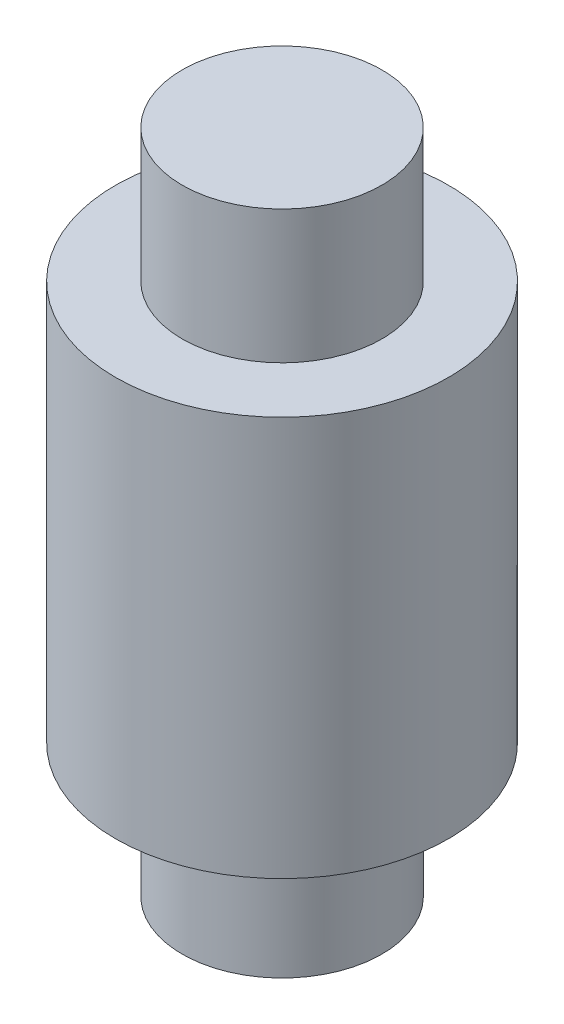
from build123d import *

# Parameters (mm, degrees)
SKETCH_1_R      = 2.5
EXTRUDE_1_DEPTH = 6
SKETCH_2_R      = 1.5
EXTRUDE_2_DEPTH = 2
EXTRUDE_START   = 2
SKETCH_4_R      = 1.5
EXTRUDE_3_DEPTH = 2


with BuildPart() as part:
    # Эскиз1 → Бобышка-Вытянуть1 (new body)
    with BuildSketch(Plane(origin=(0, 0, 0), x_dir=(1, 0, 0), z_dir=(0, 1, 0))):
        with Locations(Location((0, 0, 0), (0, 0, 270))):
            Circle(SKETCH_1_R)
    extrude(amount=EXTRUDE_1_DEPTH)

    # Эскиз2 → Бобышка-Вытянуть2 (add)
    with BuildSketch(Plane(origin=(0, 6, 0), x_dir=(1, 0, 0), z_dir=(0, 1, 0))):
        with Locations(Location((0, 0, 0), (0, 0, 270))):
            Circle(SKETCH_2_R)
    extrude(amount=EXTRUDE_2_DEPTH)

    # Эскиз4 → Бобышка-Вытянуть3 (add)
    with BuildSketch(Plane.XZ.offset(EXTRUDE_START)):
        with Locations(Location((0, 0, 0), (0, 0, 90))):
            Circle(SKETCH_4_R)
    extrude(amount=-EXTRUDE_3_DEPTH)


solid = part.part
